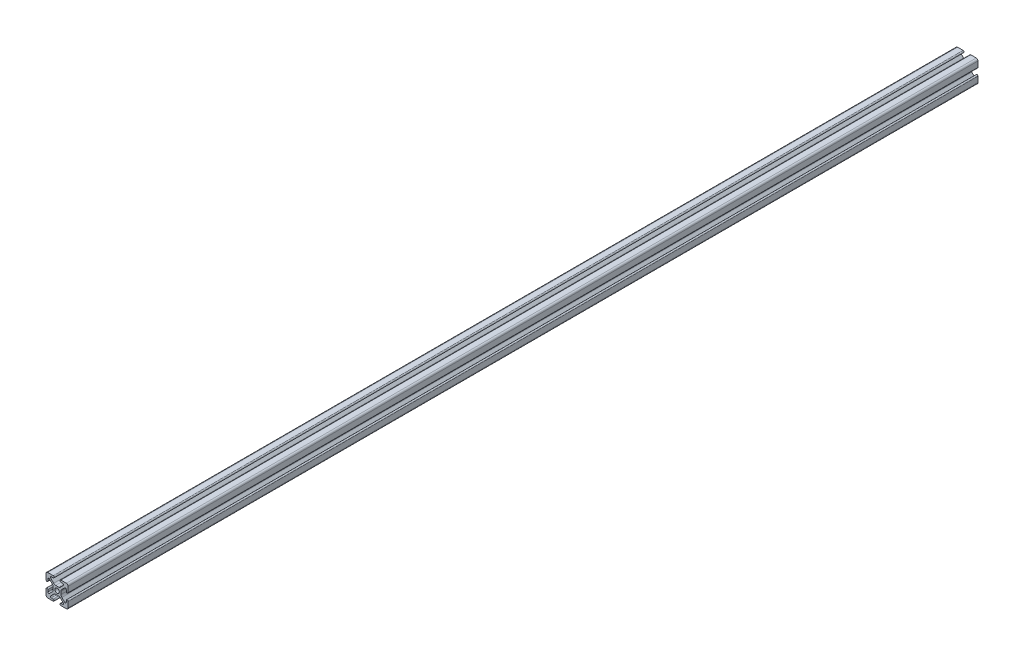
from build123d import *

# Parameters (mm, degrees)
SKETCH1_R      = 2.5
EXTRUDE1_DEPTH = 1027


with BuildPart() as part:
    # Sketch1 → Extrude1 (new body)
    with BuildSketch(Plane.XY):
        with BuildLine():
            Line((-8.636346088, 7.111588351), (-5.432204773, 3.912143135))
            ThreePointArc((-5.432204773, 3.912143135), (-4.708985779, 2.831057106), (-4.455, 1.555406707))
            Line((-4.455, 1.555406707), (-4.455, -1.555406707))
            ThreePointArc((-4.455, -1.555406707), (-4.708985779, -2.831057106), (-5.432204773, -3.912143135))
            Line((-5.432204773, -3.912143135), (-8.636346088, -7.111588351))
            ThreePointArc((-8.636346088, -7.111588351), (-9.736852394, -7.329863489), (-10.36, -6.396886949))
            Line((-10.36, -6.396886949), (-10.36, -4.32))
            ThreePointArc((-10.36, -4.32), (-11.43, -3.25), (-12.5, -4.32))
            Line((-12.5, -4.32), (-12.5, -8.651801989))
            Line((-12.5, -8.651801989), (-12.5, -10.537068835))
            ThreePointArc((-12.5, -10.537068835), (-11.925070773, -11.925070773), (-10.537068835, -12.5))
            Line((-10.537068835, -12.5), (-8.441567612, -12.5))
            Line((-8.441567612, -12.5), (-4.387856959, -12.5))
            ThreePointArc((-4.387856959, -12.5), (-3.317856959, -11.43), (-4.387856959, -10.36))
            Line((-4.387856959, -10.36), (-6.42, -10.36))
            ThreePointArc((-6.42, -10.36), (-7.35325999, -9.736168088), (-7.133653912, -8.635298598))
            Line((-7.133653912, -8.635298598), (-3.795290766, -5.301828272))
            ThreePointArc((-3.795290766, -5.301828272), (-2.76743922, -4.61585726), (-1.555406707, -4.375))
            Line((-1.555406707, -4.375), (1.555406707, -4.375))
            ThreePointArc((1.555406707, -4.375), (2.76743922, -4.61585726), (3.795290766, -5.301828272))
            Line((3.795290766, -5.301828272), (7.133653912, -8.635298598))
            ThreePointArc((7.133653912, -8.635298598), (7.35325999, -9.736168088), (6.42, -10.36))
            Line((6.42, -10.36), (4.387856959, -10.36))
            ThreePointArc((4.387856959, -10.36), (3.317856959, -11.43), (4.387856959, -12.5))
            Line((4.387856959, -12.5), (8.441567612, -12.5))
            Line((8.441567612, -12.5), (10.537068835, -12.5))
            ThreePointArc((10.537068835, -12.5), (11.925070773, -11.925070773), (12.5, -10.537068835))
            Line((12.5, -10.537068835), (12.5, -8.651801989))
            Line((12.5, -8.651801989), (12.5, -4.32))
            ThreePointArc((12.5, -4.32), (11.43, -3.25), (10.36, -4.32))
            Line((10.36, -4.32), (10.36, -6.396886949))
            ThreePointArc((10.36, -6.396886949), (9.736852394, -7.329863489), (8.636346088, -7.111588351))
            Line((8.636346088, -7.111588351), (5.432204773, -3.912143135))
            ThreePointArc((5.432204773, -3.912143135), (4.708985779, -2.831057106), (4.455, -1.555406707))
            Line((4.455, -1.555406707), (4.455, 1.555406707))
            ThreePointArc((4.455, 1.555406707), (4.708985779, 2.831057106), (5.432204773, 3.912143135))
            Line((5.432204773, 3.912143135), (8.636346088, 7.111588351))
            ThreePointArc((8.636346088, 7.111588351), (9.736852394, 7.329863489), (10.36, 6.396886949))
            Line((10.36, 6.396886949), (10.36, 4.32))
            ThreePointArc((10.36, 4.32), (11.43, 3.25), (12.5, 4.32))
            Line((12.5, 4.32), (12.5, 7.99129648))
            Line((12.5, 7.99129648), (12.5, 10.537068835))
            ThreePointArc((12.5, 10.537068835), (11.925070773, 11.925070773), (10.537068835, 12.5))
            Line((10.537068835, 12.5), (4.32, 12.5))
            ThreePointArc((4.32, 12.5), (3.25, 11.43), (4.32, 10.36))
            Line((4.32, 10.36), (6.42, 10.36))
            ThreePointArc((6.42, 10.36), (7.35325999, 9.736168088), (7.133653912, 8.635298598))
            Line((7.133653912, 8.635298598), (3.795290766, 5.301828272))
            ThreePointArc((3.795290766, 5.301828272), (2.76743922, 4.61585726), (1.555406707, 4.375))
            Line((1.555406707, 4.375), (-1.555406707, 4.375))
            ThreePointArc((-1.555406707, 4.375), (-2.76743922, 4.61585726), (-3.795290766, 5.301828272))
            Line((-3.795290766, 5.301828272), (-7.133653912, 8.635298598))
            ThreePointArc((-7.133653912, 8.635298598), (-7.35325999, 9.736168088), (-6.42, 10.36))
            Line((-6.42, 10.36), (-4.32, 10.36))
            ThreePointArc((-4.32, 10.36), (-3.25, 11.43), (-4.32, 12.5))
            Line((-4.32, 12.5), (-10.537068835, 12.5))
            ThreePointArc((-10.537068835, 12.5), (-11.925070773, 11.925070773), (-12.5, 10.537068835))
            Line((-12.5, 10.537068835), (-12.5, 7.99129648))
            Line((-12.5, 7.99129648), (-12.5, 4.32))
            ThreePointArc((-12.5, 4.32), (-11.43, 3.25), (-10.36, 4.32))
            Line((-10.36, 4.32), (-10.36, 6.396886949))
            ThreePointArc((-10.36, 6.396886949), (-9.736852394, 7.329863489), (-8.636346088, 7.111588351))
        make_face()
        Circle(SKETCH1_R, mode=Mode.SUBTRACT)
    extrude(amount=-EXTRUDE1_DEPTH)


solid = part.part
